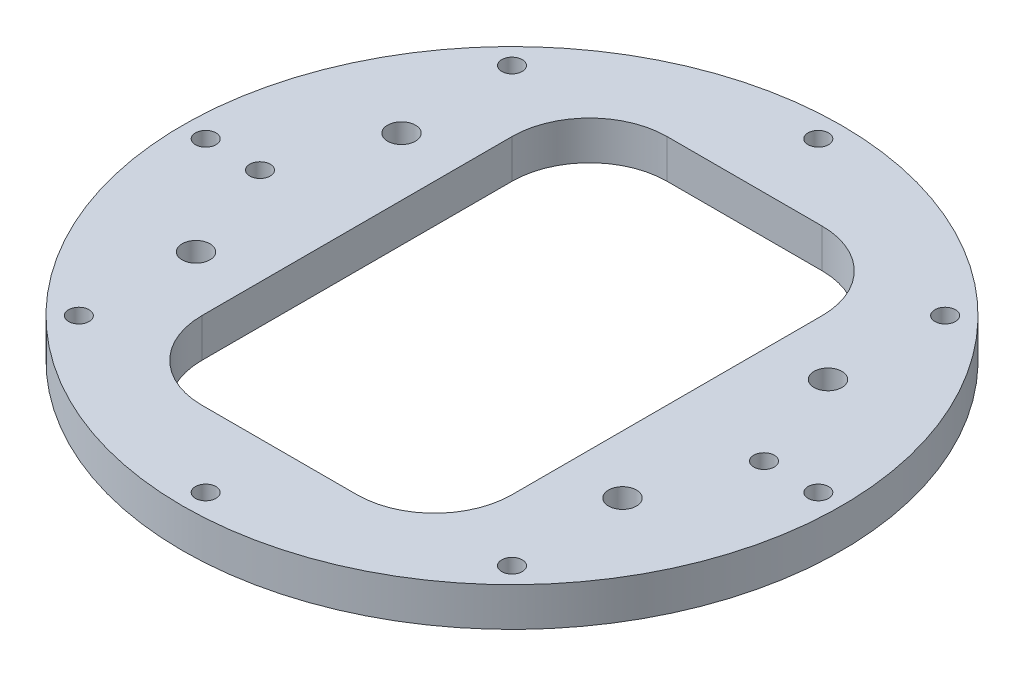
from build123d import *

# Parameters (mm, degrees)
SKETCH_1_R          = 85.5
SKETCH_1_R_2        = 2.65
SKETCH_1_W          = 80
SKETCH_1_H          = 100
EXTRUDE_3_DEPTH     = 10
SKETCH_10_R         = 3.6
SKETCH_10_R_2       = 2.65
CUT_EXTRUDE_2_DEPTH = 10
SKETCH_11_W         = 80
SKETCH_11_H         = 120
CUT_EXTRUDE_3_DEPTH = 10
FILLET_1_R          = 20
CUT_EXTRUDE_START   = -10
SKETCH_12_R         = 85.5
SKETCH_12_R_2       = 85
CUT_EXTRUDE_4_DEPTH = 10


with BuildPart() as part:
    # 草图1 → 凸台-拉伸3 (new body)
    with BuildSketch(Plane(origin=(0, 0, 0), x_dir=(1, 0, 0), z_dir=(0, 1, 0))):
        with Locations(Location((0, 0, 0), (0, 0, 270))):
            Circle(SKETCH_1_R)
        with Locations(Location((0, 79, 0), (0, 0, 270))):
            Circle(SKETCH_1_R_2, mode=Mode.SUBTRACT)
        with Locations(Location((55.861435714, 55.861435714, 0), (0, 0, 270))):
            Circle(SKETCH_1_R_2, mode=Mode.SUBTRACT)
        with Locations(Location((79, 0, 0), (0, 0, 270))):
            Circle(SKETCH_1_R_2, mode=Mode.SUBTRACT)
        with Locations(Location((55.861435714, -55.861435714, 0), (0, 0, 270))):
            Circle(SKETCH_1_R_2, mode=Mode.SUBTRACT)
        with Locations(Location((0, -79, 0), (0, 0, 270))):
            Circle(SKETCH_1_R_2, mode=Mode.SUBTRACT)
        with Locations(Location((-55.861435714, -55.861435714, 0), (0, 0, 270))):
            Circle(SKETCH_1_R_2, mode=Mode.SUBTRACT)
        with Locations(Location((-79, 0, 0), (0, 0, 270))):
            Circle(SKETCH_1_R_2, mode=Mode.SUBTRACT)
        with Locations(Location((-55.861435714, 55.861435714, 0), (0, 0, 270))):
            Circle(SKETCH_1_R_2, mode=Mode.SUBTRACT)
        Rectangle(SKETCH_1_W, SKETCH_1_H, mode=Mode.SUBTRACT)
    extrude(amount=EXTRUDE_3_DEPTH)

    # 草图10 → 切除-拉伸2 (cut)
    with BuildSketch(Plane(origin=(0, 10, 0), x_dir=(1, 0, 0), z_dir=(0, 1, 0))):
        with Locations(Location((55, 26.5, 0), (0, 0, 270))):
            Circle(SKETCH_10_R)
        with Locations(Location((65, 0, 0), (0, 0, 270))):
            Circle(SKETCH_10_R_2)
        with Locations(Location((55, -26.5, 0), (0, 0, 270))):
            Circle(SKETCH_10_R)
        with Locations(Location((-55, -26.5, 0), (0, 0, 270))):
            Circle(SKETCH_10_R)
        with Locations(Location((-55, 26.5, 0), (0, 0, 90))):
            Circle(SKETCH_10_R)
        with Locations(Location((-65, 0, 0), (0, 0, 270))):
            Circle(SKETCH_10_R_2)
    extrude(amount=-CUT_EXTRUDE_2_DEPTH, mode=Mode.SUBTRACT)

    # 草图11 → 切除-拉伸3 (cut)
    with BuildSketch(Plane(origin=(0, 10, 0), x_dir=(1, 0, 0), z_dir=(0, 1, 0))):
        Rectangle(SKETCH_11_W, SKETCH_11_H)
    extrude(amount=-CUT_EXTRUDE_3_DEPTH, mode=Mode.SUBTRACT)

    # 圆角1
    fillet_1_edges = [part.edges().sort_by_distance(p)[0] for p in [
        (40, 5, -60),
        (40, 5, 60),
        (-40, 5, 60),
        (-40, 5, -60),
    ]]
    fillet(fillet_1_edges, radius=FILLET_1_R)

    # 草图12 → 切除-拉伸4 (cut)
    with BuildSketch(Plane(origin=(0, 10, 0), x_dir=(1, 0, 0), z_dir=(0, 1, 0)).offset(CUT_EXTRUDE_START)):
        Circle(SKETCH_12_R)
        with Locations(Location((0, 0, 0), (0, 0, 270))):
            Circle(SKETCH_12_R_2, mode=Mode.SUBTRACT)
    extrude(amount=CUT_EXTRUDE_4_DEPTH, mode=Mode.SUBTRACT)


solid = part.part
